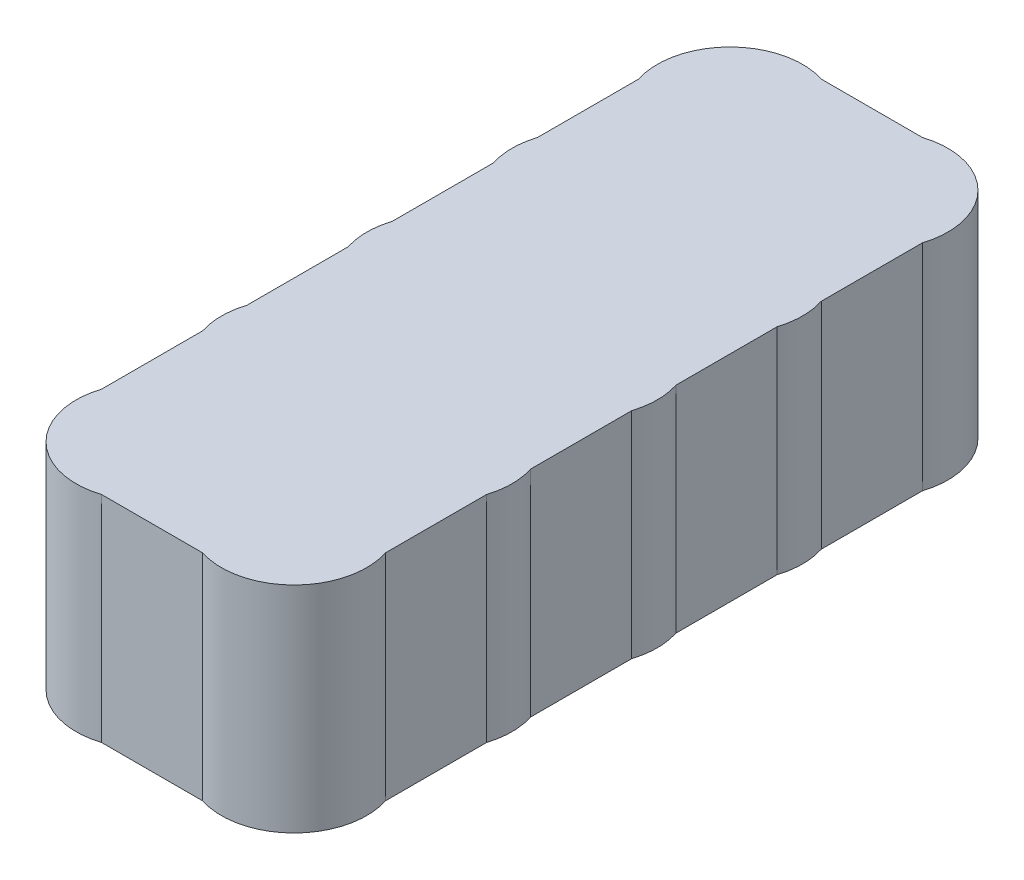
from build123d import *

# Parameters (mm, degrees)
BOSS_EXTRUDE1_DEPTH = 34
BOSS_EXTRUDE2_DEPTH = 34


with BuildPart() as part:
    # Sketch1 → Boss-Extrude1 (new body)
    with BuildSketch(Plane(origin=(0, 0, 0), x_dir=(1, 0, 0), z_dir=(0, 1, 0))):
        with BuildLine():
            ThreePointArc((0, 11.5), (-8.131727984, -8.131727984), (11.5, 0))
            ThreePointArc((11.5, 0), (31.131727984, -8.131727984), (23, 11.5))
            ThreePointArc((23, 11.5), (34.5, 23), (23, 34.5))
            ThreePointArc((23, 34.5), (34.5, 46), (23, 57.5))
            ThreePointArc((23, 57.5), (34.5, 69), (23, 80.5))
            ThreePointArc((23, 80.5), (31.131727984, 100.131727984), (11.5, 92))
            ThreePointArc((11.5, 92), (-8.131727984, 100.131727984), (0, 80.5))
            ThreePointArc((0, 80.5), (-11.5, 69), (0, 57.5))
            ThreePointArc((0, 57.5), (-11.5, 46), (0, 34.5))
            ThreePointArc((0, 34.5), (-11.5, 23), (0, 11.5))
        make_face()
    extrude(amount=BOSS_EXTRUDE1_DEPTH)

    # Sketch2 → Boss-Extrude2 (add)
    with BuildSketch(Plane(origin=(0, 34, 0), x_dir=(1, 0, 0), z_dir=(0, 1, 0))):
        Polygon((-10.95445115, 88.5), (-10.95445115, 72.5), (-10.95445115, 3.5), (3.5, -10.95445115), (19.5, -10.95445115), (33.95445115, -3.5), (33.95445115, 88.5), (19.5, 102.95445115), (3.5, 102.95445115), align=None)
    extrude(amount=-BOSS_EXTRUDE2_DEPTH)


solid = part.part
